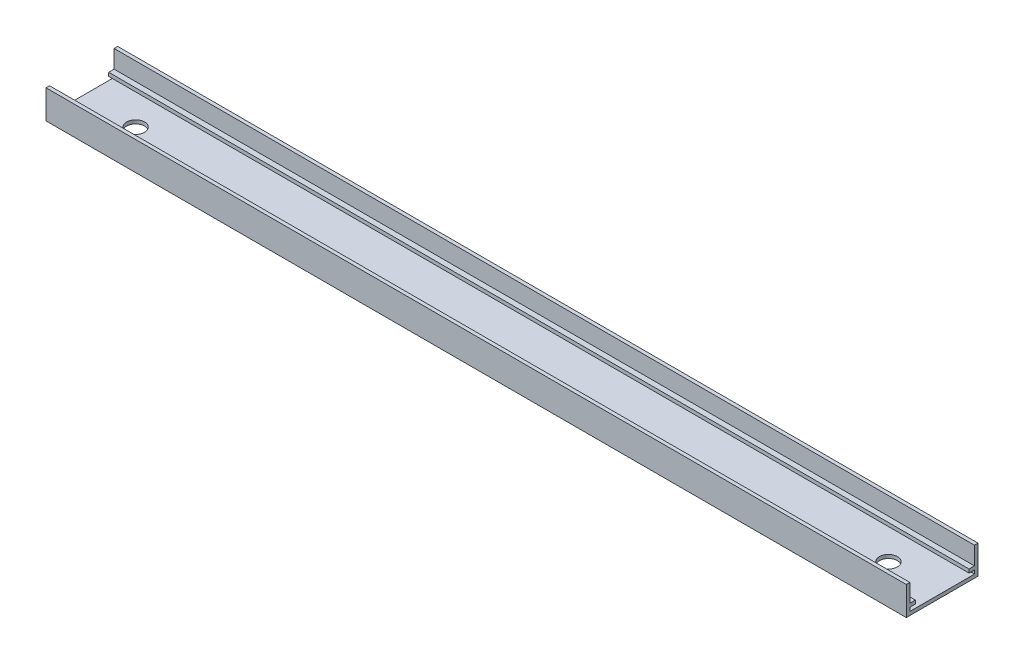
from build123d import *

# Parameters (mm, degrees)
BOSS_EXTRUDE1_DEPTH = 304.8
SKETCH2_R           = 3.175
CUT_EXTRUDE2_DEPTH  = 306.985673031


with BuildPart() as part:
    # Sketch1 → Boss-Extrude1 (new body)
    with BuildSketch(Plane(origin=(0, 0, 0), x_dir=(0, 0, -1), z_dir=(1, 0, 0))):
        Polygon((0, 0), (25.4, 0), (25.4, 10.16), (24.13, 10.16), (24.13, 3.81), (22.224108836, 3.81), (22.224108836, 2.54), (24.13, 2.54), (24.13, 1.27), (1.27, 1.27), (1.27, 2.54), (3.175891164, 2.54), (3.175891164, 3.81), (1.27, 3.81), (1.27, 10.16), (0, 10.16), align=None)
    extrude(amount=-BOSS_EXTRUDE1_DEPTH)

    # Sketch2 → Cut-Extrude2 (cut, through all)
    with BuildSketch(Plane(origin=(0, 1.27, 0), x_dir=(1, 0, 0), z_dir=(0, 1, 0))):
        with Locations(Location((-285.75, 12.7, 0), (0, 0, 270))):
            Circle(SKETCH2_R)
        with Locations(Location((-19.05, 12.7, 0), (0, 0, 90))):
            Circle(SKETCH2_R)
    extrude(amount=-CUT_EXTRUDE2_DEPTH, mode=Mode.SUBTRACT)


solid = part.part
